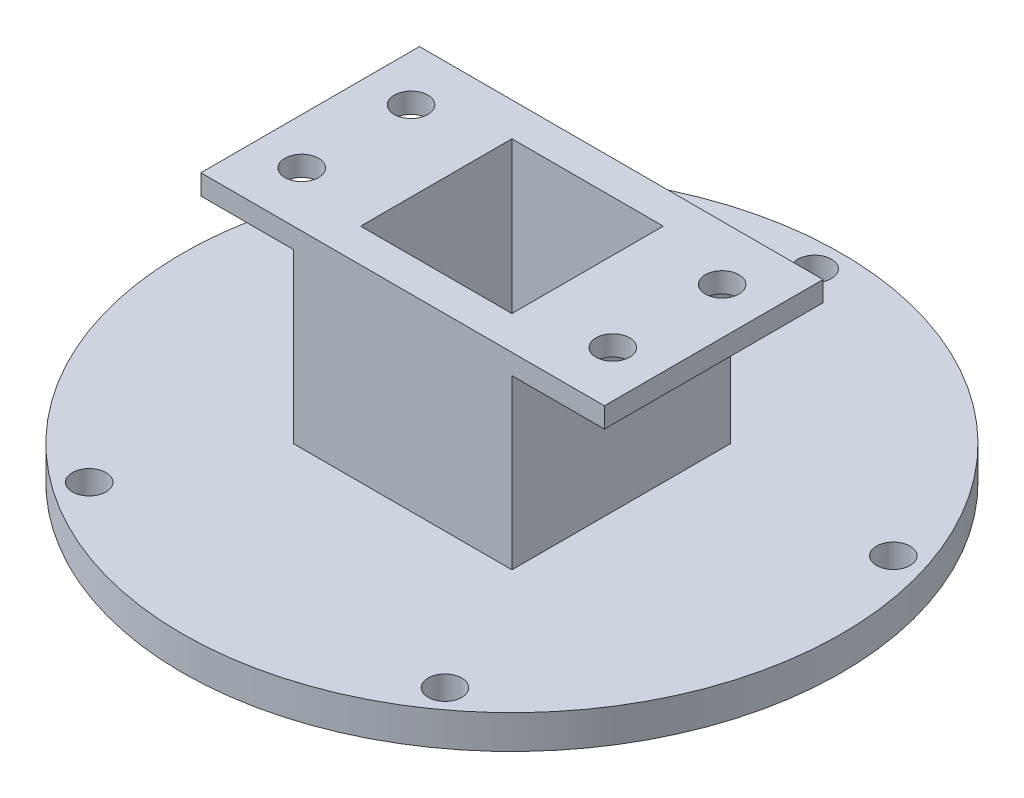
from build123d import *

# Parameters (mm, degrees)
SKETCH1_R           = 98
SKETCH1_R_2         = 5
BOSS_EXTRUDE1_DEPTH = 10
SKETCH2_W           = 65
SKETCH2_H           = 65
BOSS_EXTRUDE2_DEPTH = 50
SKETCH3_W           = 120
SKETCH3_H           = 65
SKETCH3_R           = 5
BOSS_EXTRUDE3_DEPTH = 6
SKETCH4_W           = 45
SKETCH4_H           = 45
CUT_EXTRUDE1_DEPTH  = 154.50570022


with BuildPart() as part:
    # Sketch1 → Boss-Extrude1 (new body)
    with BuildSketch(Plane(origin=(0, 0, 0), x_dir=(1, 0, 0), z_dir=(0, 1, 0))):
        with Locations(Location((0, 0, 0), (0, 0, 270))):
            Circle(SKETCH1_R)
        with Locations(Location((0, 90, 0), (0, 0, 270))):
            Circle(SKETCH1_R_2, mode=Mode.SUBTRACT)
        with Locations(Location((85.595086467, 27.811529494, 0), (0, 0, 270))):
            Circle(SKETCH1_R_2, mode=Mode.SUBTRACT)
        with Locations(Location((52.900672706, -72.811529494, 0), (0, 0, 270))):
            Circle(SKETCH1_R_2, mode=Mode.SUBTRACT)
        with Locations(Location((-52.900672706, -72.811529494, 0), (0, 0, 270))):
            Circle(SKETCH1_R_2, mode=Mode.SUBTRACT)
        with Locations(Location((-85.595086467, 27.811529494, 0), (0, 0, 270))):
            Circle(SKETCH1_R_2, mode=Mode.SUBTRACT)
    extrude(amount=BOSS_EXTRUDE1_DEPTH)

    # Sketch2 → Boss-Extrude2 (add)
    with BuildSketch(Plane(origin=(0, 10, 0), x_dir=(1, 0, 0), z_dir=(0, 1, 0))):
        Rectangle(SKETCH2_W, SKETCH2_H)
    extrude(amount=BOSS_EXTRUDE2_DEPTH)

    # Sketch3 → Boss-Extrude3 (add)
    with BuildSketch(Plane(origin=(0, 60, 0), x_dir=(1, 0, 0), z_dir=(0, 1, 0))):
        Rectangle(SKETCH3_W, SKETCH3_H)
        with Locations(Location((-46.25, 16.25, 0), (0, 0, 270))):
            Circle(SKETCH3_R, mode=Mode.SUBTRACT)
        with Locations(Location((46.25, 16.25, 0), (0, 0, 90))):
            Circle(SKETCH3_R, mode=Mode.SUBTRACT)
        with Locations(Location((46.25, -16.25, 0), (0, 0, 270))):
            Circle(SKETCH3_R, mode=Mode.SUBTRACT)
        with Locations(Location((-46.25, -16.25, 0), (0, 0, 90))):
            Circle(SKETCH3_R, mode=Mode.SUBTRACT)
    extrude(amount=BOSS_EXTRUDE3_DEPTH)

    # Sketch4 → Cut-Extrude1 (cut, through all)
    with BuildSketch(Plane(origin=(0, 66, 0), x_dir=(1, 0, 0), z_dir=(0, 1, 0))):
        Rectangle(SKETCH4_W, SKETCH4_H)
    extrude(amount=-CUT_EXTRUDE1_DEPTH, mode=Mode.SUBTRACT)


solid = part.part
